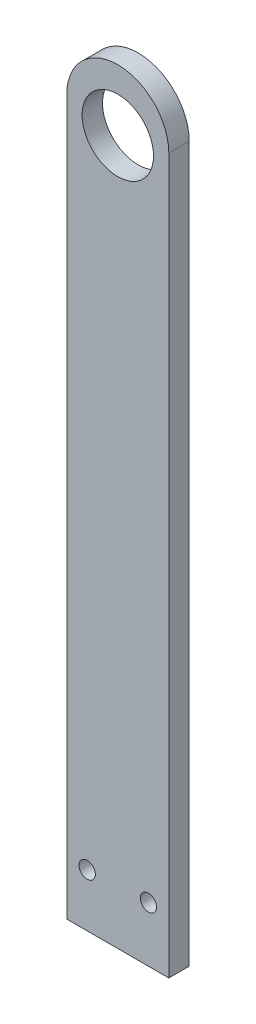
from build123d import *

# Parameters (mm, degrees)
SKETCH_1_W          = 20
SKETCH_1_H          = 150
EXTRUDE_1_DEPTH     = 4
CUT_EXTRUDE_1_DEPTH = 4
SKETCH_3_R          = 7
SKETCH_3_R_2        = 1.6
CUT_EXTRUDE_2_DEPTH = 76.769386958


with BuildPart() as part:
    # 草圖1 → 填料-伸長1 (new body)
    with BuildSketch(Plane.XY):
        Rectangle(SKETCH_1_W, SKETCH_1_H)
    extrude(amount=EXTRUDE_1_DEPTH)

    # 草圖2 → 除料-伸長1 (cut)
    with BuildSketch(Plane.XY.offset(4)):
        with BuildLine():
            ThreePointArc((-10, 65), (-7.071067812, 72.071067812), (0, 75))
            Line((0, 75), (-10, 75))
            Line((-10, 75), (-10, 65))
        make_face()
        with BuildLine():
            Line((10, 75), (0, 75))
            ThreePointArc((0, 75), (7.071067812, 72.071067812), (10, 65))
            Line((10, 65), (10, 75))
        make_face()
    extrude(amount=-CUT_EXTRUDE_1_DEPTH, mode=Mode.SUBTRACT)

    # 草圖3 → 除料-伸長2 (cut, through all)
    with BuildSketch(Plane.XY.offset(4)):
        with Locations((0, 63)):
            Circle(SKETCH_3_R)
        with Locations((-6, -64.632416386)):
            Circle(SKETCH_3_R_2)
        with Locations((6, -64.202233011)):
            Circle(SKETCH_3_R_2)
    extrude(amount=-CUT_EXTRUDE_2_DEPTH, mode=Mode.SUBTRACT)


solid = part.part
